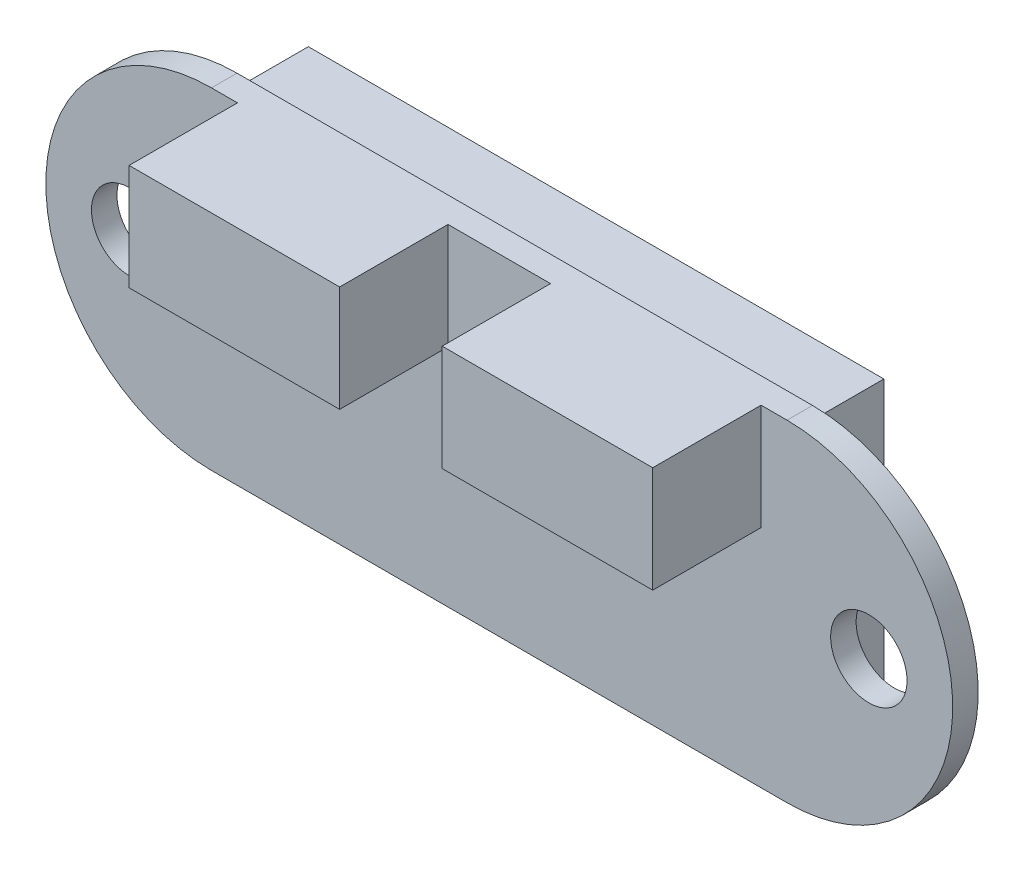
from build123d import *

# Parameters (mm, degrees)
SKETCH1_R           = 1.5
BOSS_EXTRUDE1_DEPTH = 1
SKETCH3_W           = 22.58
SKETCH3_H           = 12
SKETCH3_W_2         = 6
SKETCH3_H_2         = 4
BOSS_EXTRUDE2_DEPTH = 2.8
SKETCH4_W           = 8.26
SKETCH4_H           = 4.16
BOSS_EXTRUDE3_DEPTH = 4.25


with BuildPart() as part:
    # Sketch1 → Boss-Extrude1 (new body)
    with BuildSketch(Plane.XY):
        with BuildLine():
            Line((-73.608329156, 15.618710575), (-51.028329156, 15.618710575))
            ThreePointArc((-51.028329156, 15.618710575), (-44.528329156, 22.118710575), (-51.028329156, 28.618710575))
            Line((-51.028329156, 28.618710575), (-73.608329156, 28.618710575))
            ThreePointArc((-73.608329156, 28.618710575), (-80.108329156, 22.118710575), (-73.608329156, 15.618710575))
        make_face()
        with Locations((-76.818329156, 22.118710575)):
            Circle(SKETCH1_R, mode=Mode.SUBTRACT)
        with Locations(Location((-47.818329156, 22.118710575, 0), (0, 0, 180))):
            Circle(SKETCH1_R, mode=Mode.SUBTRACT)
    extrude(amount=BOSS_EXTRUDE1_DEPTH)

    # Sketch3 → Boss-Extrude2 (add)
    with BuildSketch(Plane(origin=(0, 0, 0), x_dir=(-1, 0, 0), z_dir=(0, 0, -1))):
        with Locations((62.318329156, 22.118710575)):
            Rectangle(SKETCH3_W, SKETCH3_H)
        with Locations((58.090026235, 22.118710575)):
            Rectangle(SKETCH3_W_2, SKETCH3_H_2, mode=Mode.SUBTRACT)
    extrude(amount=BOSS_EXTRUDE2_DEPTH)

    # Sketch4 → Boss-Extrude3 (add)
    with BuildSketch(Plane.XY.offset(1)):
        with Locations((-68.460165602, 26.538710575)):
            Rectangle(SKETCH4_W, SKETCH4_H)
        with Locations((-56.176492709, 26.538710575)):
            Rectangle(SKETCH4_W, SKETCH4_H)
    extrude(amount=BOSS_EXTRUDE3_DEPTH)


solid = part.part
